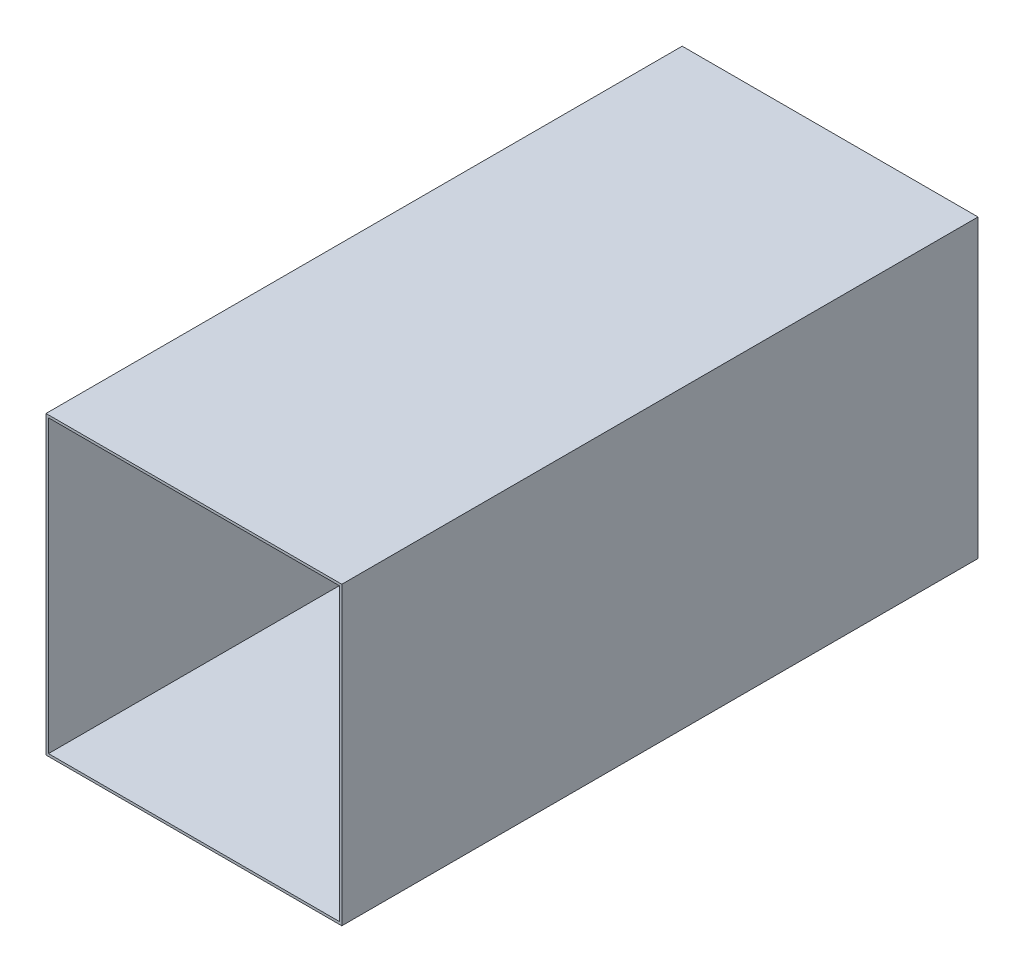
from build123d import *

# Parameters (mm, degrees)
SKETCH1_W           = 651
SKETCH1_H           = 651
SKETCH1_W_2         = 640
SKETCH1_H_2         = 640
BOSS_EXTRUDE1_DEPTH = 1400


with BuildPart() as part:
    # Sketch1 → Boss-Extrude1 (new body)
    with BuildSketch(Plane.XY):
        Rectangle(SKETCH1_W, SKETCH1_H)
        Rectangle(SKETCH1_W_2, SKETCH1_H_2, mode=Mode.SUBTRACT)
    extrude(amount=BOSS_EXTRUDE1_DEPTH)


solid = part.part
